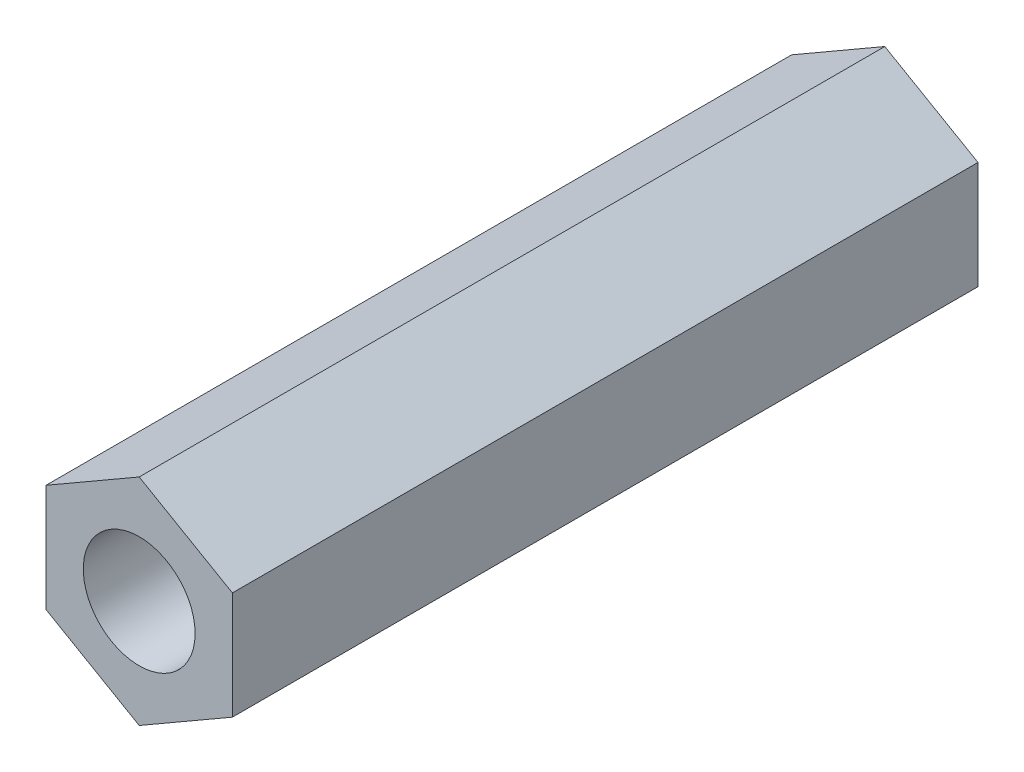
from build123d import *

# Parameters (mm, degrees)
SKETCH_1_R      = 1.5
EXTRUDE_1_DEPTH = 20


with BuildPart() as part:
    # ｽｹｯﾁ1 → ﾎﾞｽ - 押し出し1 (new body)
    with BuildSketch(Plane.XY):
        Polygon((0, -2.886751346), (2.5, -1.443375673), (2.5, 1.443375673), (0, 2.886751346), (-2.5, 1.443375673), (-2.5, -1.443375673), align=None)
        Circle(SKETCH_1_R, mode=Mode.SUBTRACT)
    extrude(amount=EXTRUDE_1_DEPTH)


solid = part.part
